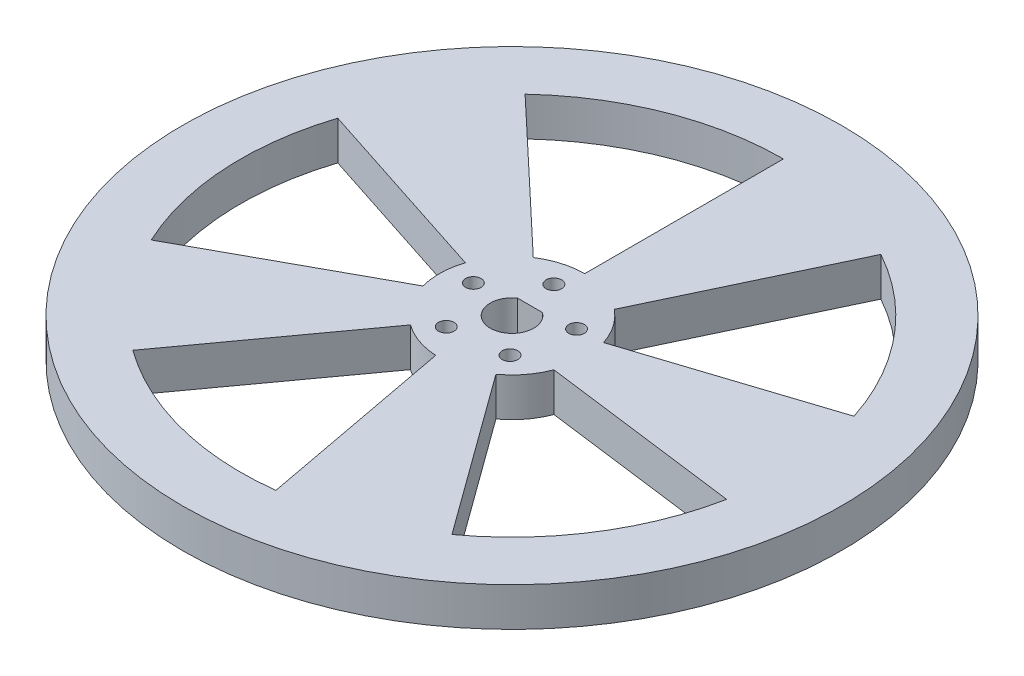
from build123d import *

# Parameters (mm, degrees)
SKETCH2_R           = 43.18
BOSS_EXTRUDE1_DEPTH = 5.08
CUT_EXTRUDE1_DEPTH  = 62.276677456
CUT_EXTRUDE2_DEPTH  = 62.276677456
SKETCH6_R           = 1.016
CUT_EXTRUDE3_DEPTH  = 62.276677456


with BuildPart() as part:
    # Sketch2 → Boss-Extrude1 (new body)
    with BuildSketch(Plane(origin=(0, 0, 0), x_dir=(1, 0, 0), z_dir=(0, 1, 0))):
        with Locations(Location((0, 0, 0), (0, 0, 270))):
            Circle(SKETCH2_R)
    extrude(amount=BOSS_EXTRUDE1_DEPTH)

    # Sketch3 → Cut-Extrude1 (cut, through all)
    with BuildSketch(Plane(origin=(0, 5.08, 0), x_dir=(1, 0, 0), z_dir=(0, 1, 0))):
        with BuildLine():
            Line((1.626393556, 2.3495), (-1.626393556, 2.3495))
            ThreePointArc((-1.626393556, 2.3495), (-1.326251609, -2.531079398), (2.8575, 0))
            ThreePointArc((2.8575, 0), (2.531079398, 1.326251609), (1.626393556, 2.3495))
        make_face()
    extrude(amount=-CUT_EXTRUDE1_DEPTH, mode=Mode.SUBTRACT)

    # Sketch5 → Cut-Extrude2 (cut, through all)
    with BuildSketch(Plane(origin=(0, 5.08, 0), x_dir=(1, 0, 0), z_dir=(0, 1, 0))):
        with BuildLine():
            Line((-9.058813318, 2.943386871), (-33.819569719, 10.98864432))
            ThreePointArc((-33.819569719, 10.98864432), (-35.492818655, -2.184816682), (-32.216498168, -15.053599097))
            Line((-32.216498168, -15.053599097), (-9.197962288, -2.474492827))
            ThreePointArc((-9.197962288, -2.474492827), (-9.521860059, 0.244552684), (-9.058813318, 2.943386871))
        make_face()
        with BuildLine():
            Line((-5.598654528, -7.705886871), (-20.901643572, -28.76864432))
            ThreePointArc((-20.901643572, -28.76864432), (-8.89, -34.430821948), (4.361378082, -35.291528463))
            Line((4.361378082, -35.291528463), (-0.488944133, -9.512442307))
            ThreePointArc((-0.488944133, -9.512442307), (-3.175, -8.980256121), (-5.598654528, -7.705886871))
        make_face()
        with BuildLine():
            Line((5.598654528, -7.705886871), (20.901643572, -28.76864432))
            ThreePointArc((20.901643572, -28.76864432), (29.9893062, -19.109032253), (34.905459287, -6.79135568))
            Line((34.905459287, -6.79135568), (8.894976784, -3.406613129))
            ThreePointArc((8.894976784, -3.406613129), (7.558920282, -5.795545631), (5.598654528, -7.705886871))
        make_face()
        with BuildLine():
            ThreePointArc((33.819569719, 10.98864432), (27.430090445, 22.629709193), (17.215410974, 31.115))
            Line((17.215410974, 31.115), (5.986837414, 7.408333333))
            ThreePointArc((5.986837414, 7.408333333), (7.847091067, 5.39896164), (9.058813318, 2.943386871))
            Line((9.058813318, 2.943386871), (33.819569719, 10.98864432))
        make_face()
        with BuildLine():
            ThreePointArc((0, 35.56), (-13.045768285, 33.080530979), (-24.272268948, 25.987892567))
            Line((-24.272268948, 25.987892567), (-5.195709188, 7.983121635))
            ThreePointArc((-5.195709188, 7.983121635), (-2.709833153, 9.131397992), (0, 9.525))
            Line((0, 9.525), (0, 35.56))
        make_face()
    extrude(amount=-CUT_EXTRUDE2_DEPTH, mode=Mode.SUBTRACT)

    # Sketch6 → Cut-Extrude3 (cut, through all)
    with BuildSketch(Plane(origin=(0, 5.08, 0), x_dir=(1, 0, 0), z_dir=(0, 1, 0))):
        with Locations(Location((5.738468444, 2.718911532, 0), (0, 0, 270))):
            Circle(SKETCH6_R)
        with Locations(Location((4.3591228, -4.617417938, 0), (0, 0, 270))):
            Circle(SKETCH6_R)
        with Locations(Location((-6.240654593, 1.173341487, 0), (0, 0, 270))):
            Circle(SKETCH6_R)
        with Locations(Location((-0.812554258, 6.297797677, 0), (0, 0, 270))):
            Circle(SKETCH6_R)
        with Locations(Location((-3.044382392, -5.572632757, 0), (0, 0, 270))):
            Circle(SKETCH6_R)
    extrude(amount=-CUT_EXTRUDE3_DEPTH, mode=Mode.SUBTRACT)


solid = part.part
